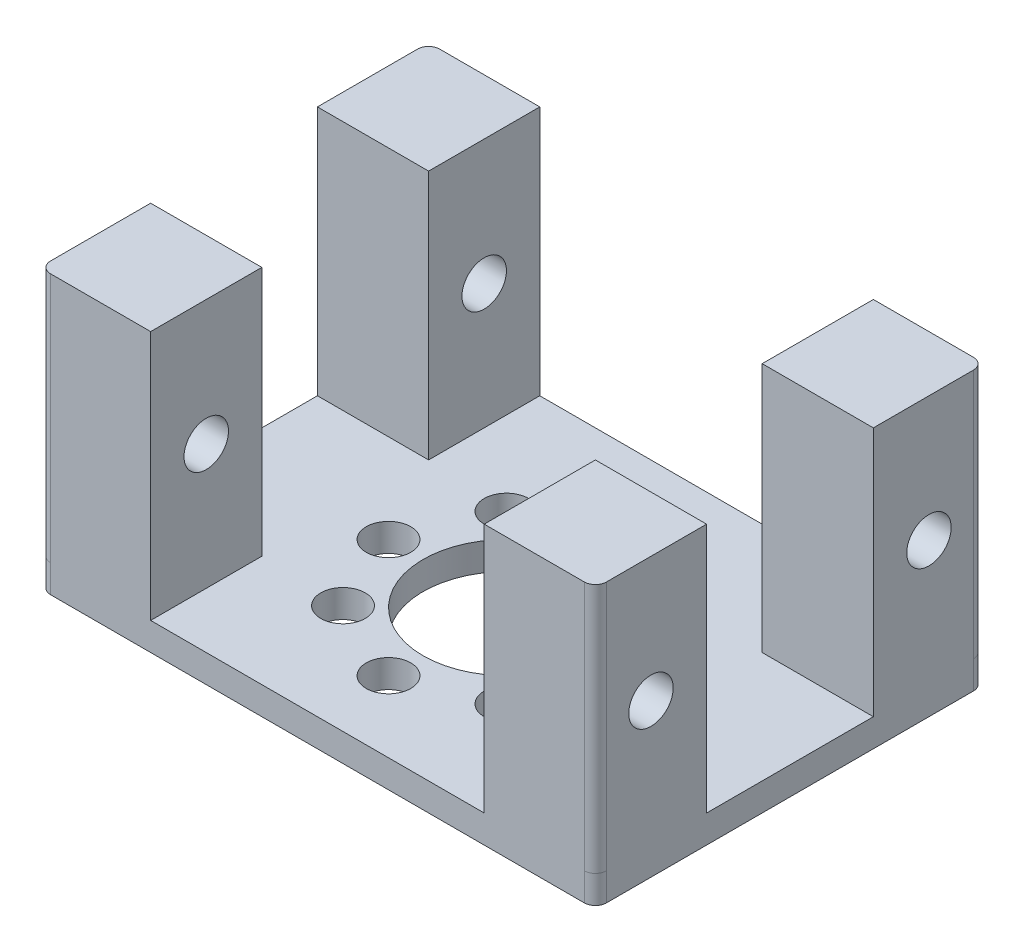
from build123d import *

# Parameters (mm, degrees)
SKETCH1_R           = 15
SKETCH1_R_2         = 4
BOSS_EXTRUDE1_DEPTH = 5
SKETCH4_W           = 20
SKETCH4_H           = 45
SKETCH4_R           = 4
BOSS_EXTRUDE2_DEPTH = 20
BOSS_EXTRUDE3_START = -20
SKETCH6_W           = 20
SKETCH6_H           = 45
SKETCH6_R           = 4
BOSS_EXTRUDE3_DEPTH = 20
FILLET1_R           = 2
FILLET2_R           = 2
FILLET3_R           = 2


with BuildPart() as part:
    # Sketch1 → Boss-Extrude1 (new body)
    with BuildSketch(Plane(origin=(0, 0, 0), x_dir=(1, 0, 0), z_dir=(0, 1, 0))):
        with BuildLine():
            Line((-2, 0), (-98, 0))
            ThreePointArc((-98, 0), (-99.414213562, -0.585786438), (-100, -2))
            Line((-100, -2), (-100, -68))
            ThreePointArc((-100, -68), (-99.414213562, -69.414213562), (-98, -70))
            Line((-98, -70), (-2, -70))
            ThreePointArc((-2, -70), (-0.585786438, -69.414213562), (0, -68))
            Line((0, -68), (0, -2))
            ThreePointArc((0, -2), (-0.585786438, -0.585786438), (-2, 0))
        make_face()
        with Locations(Location((-50, -36, 0), (0, 0, 270))):
            Circle(SKETCH1_R, mode=Mode.SUBTRACT)
        with Locations(Location((-35, -21, 0), (0, 0, 270))):
            Circle(SKETCH1_R_2, mode=Mode.SUBTRACT)
        with Locations(Location((-65, -21, 0), (0, 0, 270))):
            Circle(SKETCH1_R_2, mode=Mode.SUBTRACT)
        with Locations(Location((-65, -50.396825397, 0), (0, 0, 270))):
            Circle(SKETCH1_R_2, mode=Mode.SUBTRACT)
        with Locations(Location((-35, -51, 0), (0, 0, 270))):
            Circle(SKETCH1_R_2, mode=Mode.SUBTRACT)
        with Locations(Location((-50, -14.786796564, 0), (0, 0, 270))):
            Circle(SKETCH1_R_2, mode=Mode.SUBTRACT)
        with Locations(Location((-28.786796564, -36, 0), (0, 0, 270))):
            Circle(SKETCH1_R_2, mode=Mode.SUBTRACT)
        with Locations(Location((-50, -57.213203436, 0), (0, 0, 270))):
            Circle(SKETCH1_R_2, mode=Mode.SUBTRACT)
        with Locations(Location((-71.213203436, -36, 0), (0, 0, 270))):
            Circle(SKETCH1_R_2, mode=Mode.SUBTRACT)
    extrude(amount=BOSS_EXTRUDE1_DEPTH)

    # Sketch4 → Boss-Extrude2 (add)
    # profile 1 of 2: a face of its own
    with BuildSketch(Plane(origin=(0, 0, 0), x_dir=(0, 0, -1), z_dir=(1, 0, 0))):
        with Locations((-10, 27.5)):
            Rectangle(SKETCH4_W, SKETCH4_H)
        with Locations((-10, 27.5)):
            Circle(SKETCH4_R, mode=Mode.SUBTRACT)
    # profile 2 of 2: a face of its own
    with BuildSketch(Plane(origin=(0, 0, 0), x_dir=(0, 0, -1), z_dir=(1, 0, 0))):
        with Locations((-60, 27.5)):
            Rectangle(SKETCH4_W, SKETCH4_H)
        with Locations((-60, 27.5)):
            Circle(SKETCH4_R, mode=Mode.SUBTRACT)
    extrude(amount=-BOSS_EXTRUDE2_DEPTH)

    # Sketch6 → Boss-Extrude3 (add)
    # profile 1 of 2: a face of its own
    with BuildSketch(Plane.ZY.offset(100).offset(BOSS_EXTRUDE3_START)):
        with Locations((10, 27.5)):
            Rectangle(SKETCH6_W, SKETCH6_H)
        with Locations(Location((10, 27.5, 0), (0, 0, 180))):
            Circle(SKETCH6_R, mode=Mode.SUBTRACT)
    # profile 2 of 2: a face of its own
    with BuildSketch(Plane.ZY.offset(100).offset(BOSS_EXTRUDE3_START)):
        with Locations((60, 27.5)):
            Rectangle(SKETCH6_W, SKETCH6_H)
        with Locations(Location((60, 27.5, 0), (0, 0, 180))):
            Circle(SKETCH6_R, mode=Mode.SUBTRACT)
    extrude(amount=BOSS_EXTRUDE3_DEPTH)

    # Fillet1
    fillet1_edges = [part.edges().sort_by_distance(p)[0] for p in [
        (-100, 27.5, 70),
        (-100, 27.5, 0),
    ]]
    fillet(fillet1_edges, radius=FILLET1_R)

    # Fillet2
    fillet2_edges = [part.edges().sort_by_distance(p)[0] for p in [
        (0, 27.5, 0),
    ]]
    fillet(fillet2_edges, radius=FILLET2_R)

    # Fillet3
    fillet3_edges = [part.edges().sort_by_distance(p)[0] for p in [
        (0, 27.5, 70),
    ]]
    fillet(fillet3_edges, radius=FILLET3_R)


solid = part.part
